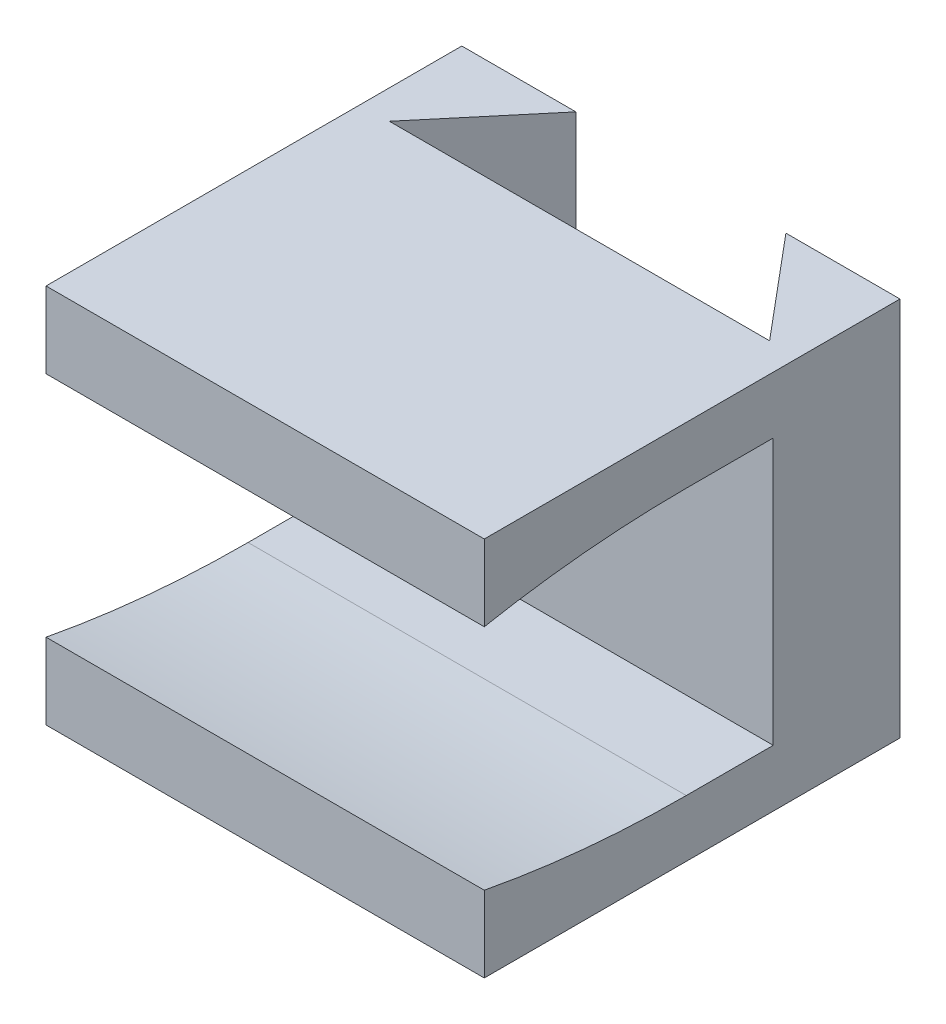
from build123d import *

# Parameters (mm, degrees)
BOSS_EXTRUDE1_DEPTH = 15
BOSS_EXTRUDE2_DEPTH = 17.29


with BuildPart() as part:
    # Sketch2 → Boss-Extrude1 (new body)
    with BuildSketch(Plane(origin=(0, 0, 0), x_dir=(1, 0, 0), z_dir=(0, 1, 0))):
        Polygon((0, 0), (15, 0), (11.643601475, 4), (13.143601475, 4), (16.143601475, 4), (16.143601475, -1), (-1.143601475, -1), (-1.143601475, 4), (1.856398525, 4), (3.356398525, 4), align=None)
    extrude(amount=BOSS_EXTRUDE1_DEPTH)

    # Sketch5 → Boss-Extrude2 (add)
    with BuildSketch(Plane(origin=(16.143601475, 0, 0), x_dir=(0, 0, -1), z_dir=(1, 0, 0))):
        with BuildLine():
            Line((-1, 2.25), (-4.43, 2.25))
            ThreePointArc((-4.43, 2.25), (-8.432605401, 2.437913267), (-12.4, 3))
            Line((-12.4, 3), (-12.4, 0))
            Line((-12.4, 0), (-1, 0))
            Line((-1, 0), (-1, 2.25))
        make_face()
        with BuildLine():
            Line((-1, 12.75), (-4.43, 12.75))
            ThreePointArc((-4.43, 12.75), (-8.432605401, 12.562086733), (-12.4, 12))
            Line((-12.4, 12), (-12.4, 15))
            Line((-12.4, 15), (-1, 15))
            Line((-1, 15), (-1, 12.75))
        make_face()
    extrude(amount=-BOSS_EXTRUDE2_DEPTH)


solid = part.part
